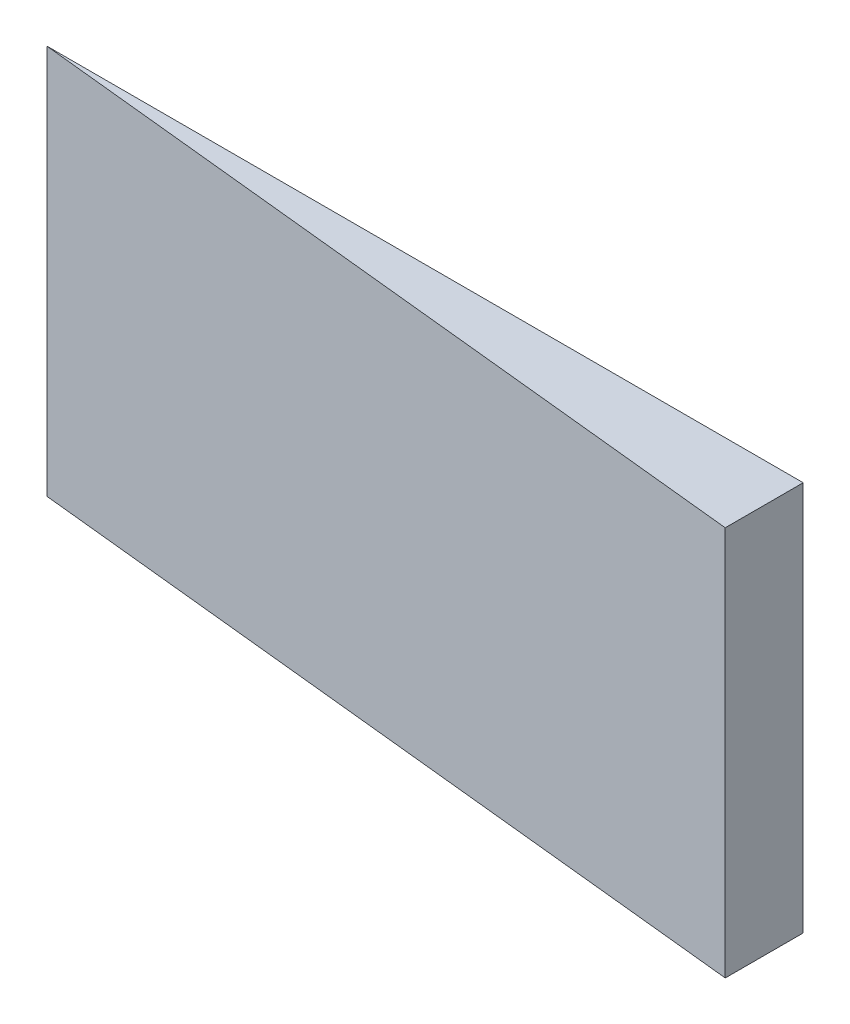
from build123d import *

# Parameters (mm, degrees)
BOSS_EXTRUDE1_DEPTH = 25


with BuildPart() as part:
    # Sketch1 → Boss-Extrude1 (new body)
    with BuildSketch(Plane(origin=(0, 0, 0), x_dir=(1, 0, 0), z_dir=(0, 1, 0))):
        Polygon((0, 0), (0, -5), (-48.5, 0), align=None)
    extrude(amount=BOSS_EXTRUDE1_DEPTH)


solid = part.part
